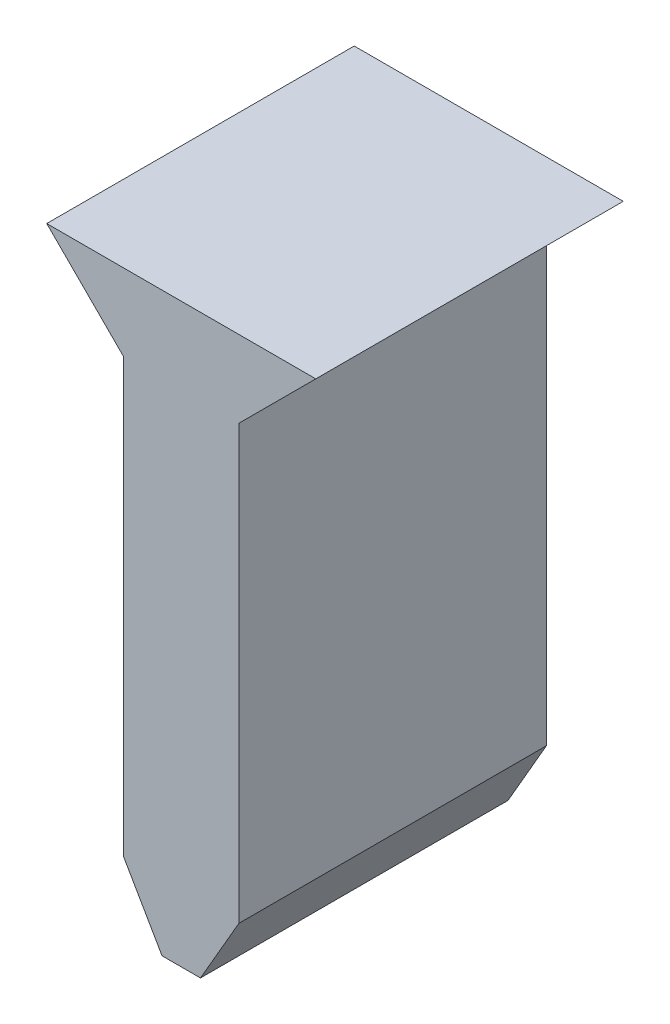
from build123d import *

# Parameters (mm, degrees)
SKETCH1_W           = 3
SKETCH1_H           = 13
BOSS_EXTRUDE1_DEPTH = 4
BOSS_EXTRUDE2_DEPTH = 8
CHAMFER1_SIZE       = 1
CHAMFER1_SIZE2      = 1.732050808


with BuildPart() as part:
    # Sketch1 → Boss-Extrude1 (new, symmetric)
    with BuildSketch(Plane.XY):
        Rectangle(SKETCH1_W, SKETCH1_H)
    extrude(amount=BOSS_EXTRUDE1_DEPTH, both=True)

    # Sketch2 → Boss-Extrude2 (add)
    with BuildSketch(Plane.XY.offset(4)):
        Polygon((-1.5, 6.5), (-3.5, 8.5), (3.5, 8.5), (1.5, 6.5), align=None)
    extrude(amount=-BOSS_EXTRUDE2_DEPTH)

    # Chamfer1
    chamfer1_edges = [part.edges().sort_by_distance(p)[0] for p in [
        (1.5, -6.5, 0),
        (-1.5, -6.5, 0),
    ]]
    chamfer1_side = [part.faces().sort_by_distance(p)[0] for p in [
        (0, -6.5, 0),
    ]]
    chamfer(chamfer1_edges, length=CHAMFER1_SIZE, length2=CHAMFER1_SIZE2, reference=chamfer1_side[0])


solid = part.part
